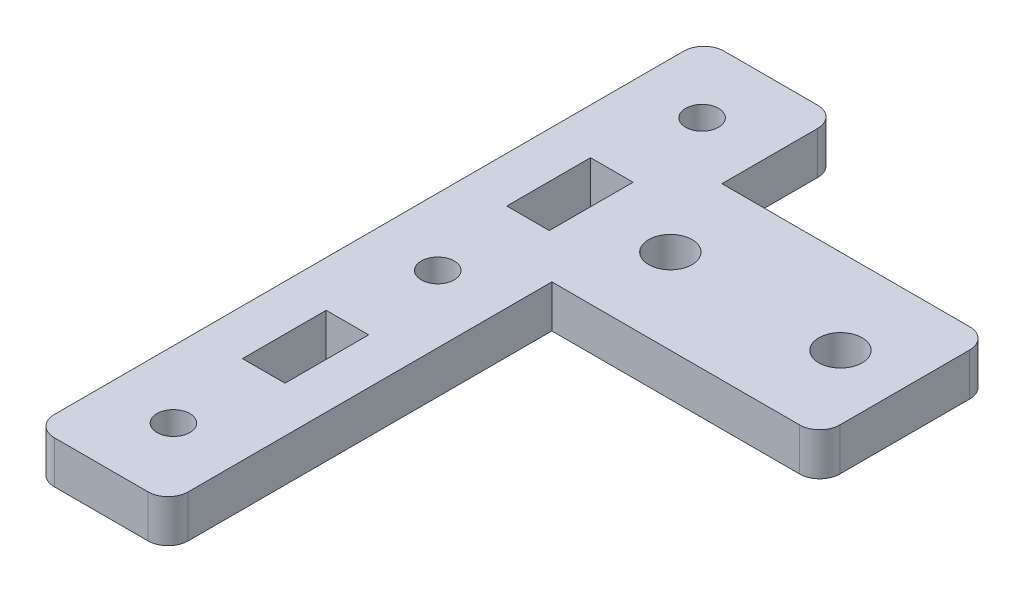
from build123d import *

# Parameters (mm, degrees)
BOSS_EXTRUDE1_DEPTH          = 6.35
SKETCH2_W                    = 6.35
SKETCH2_H                    = 12.5
CUT_EXTRUDE1_DEPTH           = 117.791791236
F_10_0_1935_DIAMETER_HOLE2_D = 4.9149
SKETCH7_R                    = 3.24358
CUT_EXTRUDE2_DEPTH           = 117.791791236
FILLET1_R                    = 3


with BuildPart() as part:
    # Sketch1 → Boss-Extrude1 (new body)
    with BuildSketch(Plane(origin=(0, 0, 0), x_dir=(1, 0, 0), z_dir=(0, 1, 0))):
        Polygon((0, 0), (20, 0), (20, 57.3), (60, 57.3), (60, 82.7), (20, 82.7), (20, 100), (0, 100), align=None)
    extrude(amount=BOSS_EXTRUDE1_DEPTH)

    # Sketch2 → Cut-Extrude1 (cut, through all)
    with BuildSketch(Plane(origin=(0, 6.35, 0), x_dir=(1, 0, 0), z_dir=(0, 1, 0))):
        with Locations((10, 70)):
            Rectangle(SKETCH2_W, SKETCH2_H)
        with Locations((10, 30.5258)):
            Rectangle(SKETCH2_W, SKETCH2_H)
    extrude(amount=-CUT_EXTRUDE1_DEPTH, mode=Mode.SUBTRACT)

    # #10 (0.1935) Diameter Hole2 (through all)
    with Locations(Plane(origin=(0, 6.35, 0), x_dir=(1, 0, 0), z_dir=(0, 1, 0))):
        with Locations((10, 89.7371), (10, 50.2629), (10, 10.7887)):
            Hole(F_10_0_1935_DIAMETER_HOLE2_D / 2)

    # Sketch7 → Cut-Extrude2 (cut, through all)
    with BuildSketch(Plane(origin=(0, 6.35, 0), x_dir=(1, 0, 0), z_dir=(0, 1, 0))):
        with Locations(Location((25, 70, 0), (0, 0, 270))):
            Circle(SKETCH7_R)
        with Locations(Location((50.4, 70, 0), (0, 0, 270))):
            Circle(SKETCH7_R)
    extrude(amount=-CUT_EXTRUDE2_DEPTH, mode=Mode.SUBTRACT)

    # Fillet1
    fillet1_edges = [part.edges().sort_by_distance(p)[0] for p in [
        (0, 3.175, -100),
        (20, 3.175, -100),
        (60, 3.175, -82.7),
        (60, 3.175, -57.3),
        (20, 3.175, 0),
        (0, 3.175, 0),
    ]]
    fillet(fillet1_edges, radius=FILLET1_R)


solid = part.part
